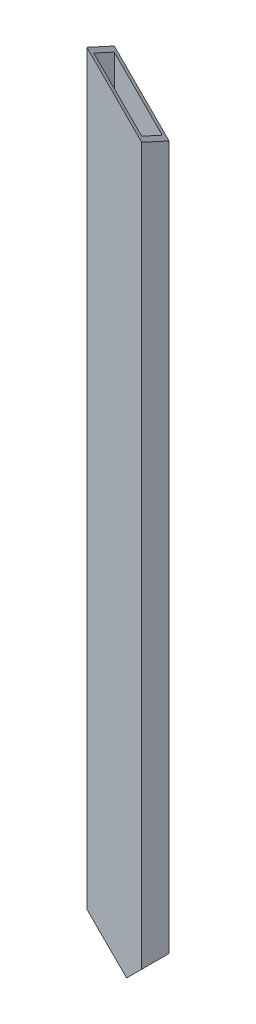
from build123d import *

# Parameters (mm, degrees)
SKETCH1_W           = 50.8
SKETCH1_H           = 25.4
SKETCH1_W_2         = 44.45
SKETCH1_H_2         = 19.05
BOSS_EXTRUDE1_DEPTH = 728.3704
CUT_EXTRUDE1_DEPTH  = 730.255620202
CUT_EXTRUDE2_DEPTH  = 728.6244


with BuildPart() as part:
    # Sketch1 → Boss-Extrude1 (new body)
    with BuildSketch(Plane(origin=(0, 0, 0), x_dir=(1, 0, 0), z_dir=(0, 1, 0))):
        Rectangle(SKETCH1_W, SKETCH1_H)
        Rectangle(SKETCH1_W_2, SKETCH1_H_2, mode=Mode.SUBTRACT)
    extrude(amount=BOSS_EXTRUDE1_DEPTH)

    # Sketch2 → Cut-Extrude1 (cut, through all)
    with BuildSketch(Plane.XY.offset(12.7)):
        Polygon((25.4, 728.3704), (-25.4, 728.3704), (25.4, 677.5704), align=None)
        Polygon((11.4046, 0), (-25.4, 36.8046), (-25.4, 0), align=None)
        Polygon((25.4, 0), (25.4, 13.9954), (11.4046, 0), align=None)
    extrude(amount=-CUT_EXTRUDE1_DEPTH, mode=Mode.SUBTRACT)

    # Sketch3 → Cut-Extrude2 (cut)
    with BuildSketch(Plane(origin=(-376.8852, 376.8852, 0), x_dir=(0, 0, 1), z_dir=(-0.7071067811865563, 0.7071067811865388, 0))):
        Polygon((12.7, 497.075136813), (-12.7, 488.822176529), (-12.7, 497.075136813), align=None)
    extrude(amount=-CUT_EXTRUDE2_DEPTH, mode=Mode.SUBTRACT)


solid = part.part
